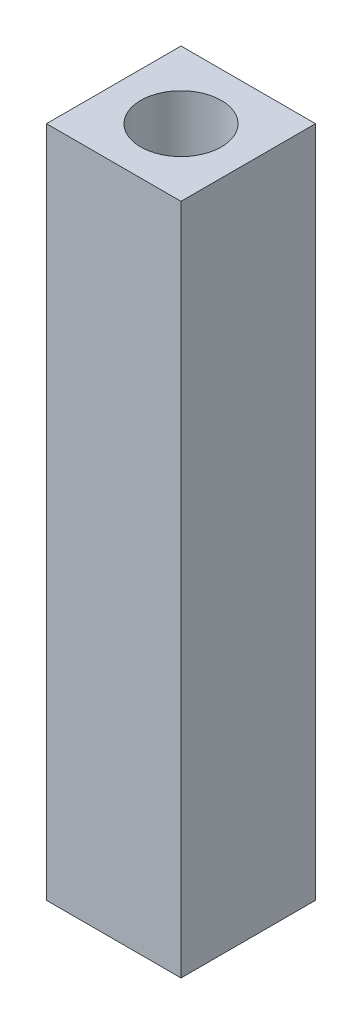
from build123d import *

# Parameters (mm, degrees)
SKETCH1_W           = 10
SKETCH1_H           = 10
BOSS_EXTRUDE1_DEPTH = 50
SKETCH2_R           = 3
CUT_EXTRUDE1_DEPTH  = 20
LPATTERN1_COUNT     = 2
LPATTERN1_PITCH     = 30


with BuildPart() as part:
    # Sketch1 → Boss-Extrude1 (new body)
    with BuildSketch(Plane(origin=(0, 0, 0), x_dir=(1, 0, 0), z_dir=(0, 1, 0))):
        Rectangle(SKETCH1_W, SKETCH1_H)
    extrude(amount=BOSS_EXTRUDE1_DEPTH)

    # Sketch2 → Cut-Extrude1 (cut)
    with BuildSketch(Plane.XZ):
        with Locations(Location((0, 0, 0), (0, 0, 270))):
            Circle(SKETCH2_R)
    cut_extrude1 = extrude(amount=-CUT_EXTRUDE1_DEPTH, mode=Mode.SUBTRACT)

    # LPattern1: Cut-Extrude1 ×2
    with Locations(*[(0, i * LPATTERN1_PITCH, 0) for i in range(1, LPATTERN1_COUNT)]):
        add(cut_extrude1, mode=Mode.SUBTRACT)


solid = part.part
